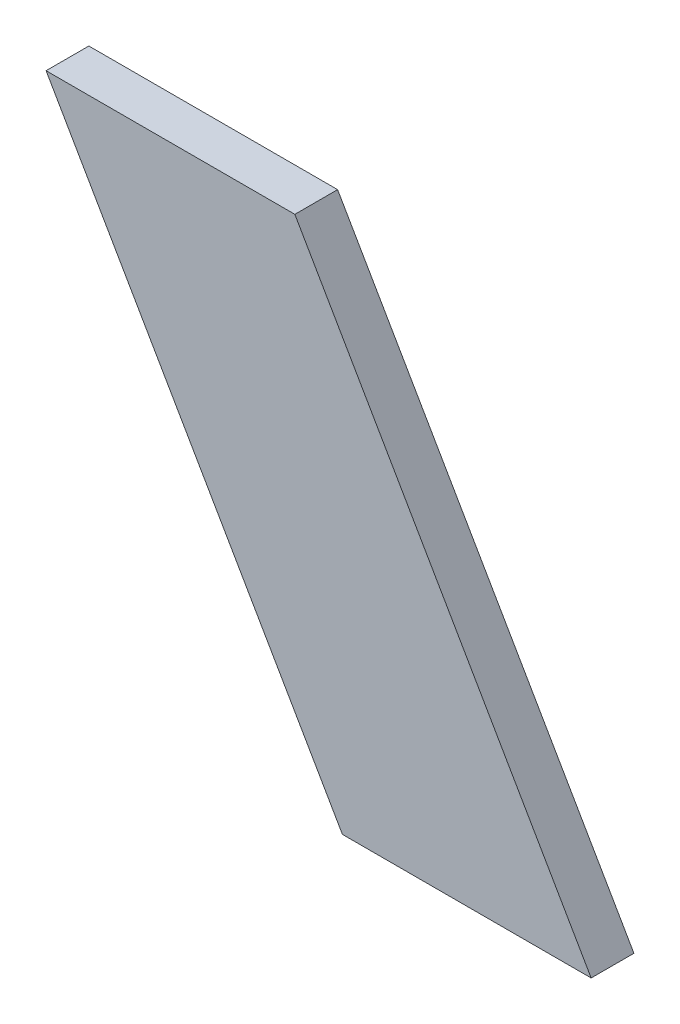
from build123d import *

# Parameters (mm, degrees)
BOSS_EXTRUDE1_DEPTH      = 3
BOSS_EXTRUDE1_DEPTH_BACK = 3


with BuildPart() as part:
    # Sketch1 → Boss-Extrude1 (new, two sides: drawn at the far end of the back side and taken through both)
    with BuildSketch(Plane.XY.offset(-BOSS_EXTRUDE1_DEPTH_BACK)):
        Polygon((22.9, 0), (57.8, 0), (99.369219382, -72), (64.469219382, -72), align=None)
    extrude(amount=BOSS_EXTRUDE1_DEPTH + BOSS_EXTRUDE1_DEPTH_BACK)


solid = part.part
